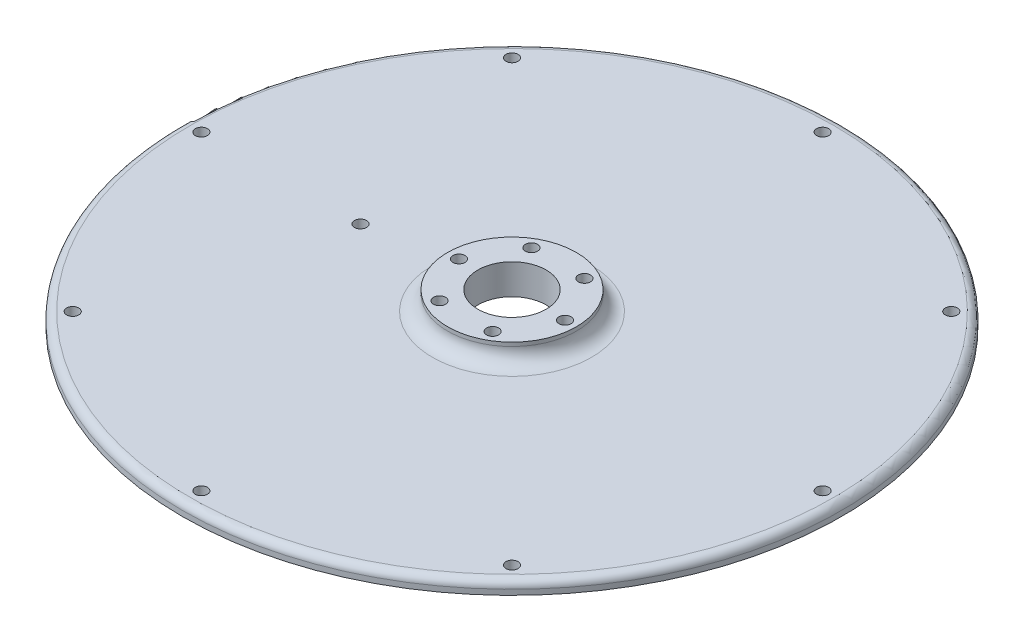
from build123d import *

# Parameters (mm, degrees)
CUT_EXTRUDE1_DEPTH      = 617.614952787
CUT_EXTRUDE1_DEPTH_BACK = 617.614952787
SKETCH2_R               = 8
CUT_EXTRUDE2_DEPTH      = 618.636624562
CUT_EXTRUDE2_DEPTH_BACK = 20
SKETCH3_R               = 8
SKETCH4_R               = 8
CUT_EXTRUDE3_DEPTH      = 15


with BuildPart() as part:
    # Sketch1 → Revolve1 (revolve)
    with BuildSketch(Plane.XY, mode=Mode.PRIVATE) as revolve1_sk:
        with BuildLine():
            Line((-365, 0), (-385, 0))
            Line((-385, 0), (-385, 13))
            Line((-385, 13), (-435, 13))
            Line((-435, 13), (-435, 20))
            ThreePointArc((-435, 20), (-432.071067812, 27.071067812), (-425, 30))
            Line((-425, 30), (-105, 30))
            ThreePointArc((-105, 30), (-90.857864376, 35.857864376), (-85, 50))
            Line((-85, 50), (-85, 55))
            Line((-85, 55), (-45, 55))
            Line((-45, 55), (-45, 15))
            Line((-45, 15), (-355, 15))
            ThreePointArc((-355, 15), (-362.071067812, 12.071067812), (-365, 5))
            Line((-365, 5), (-365, 0))
        make_face()
    revolve(revolve1_sk.sketch.rotate(Axis((0, 0, 0), (0, 1, 0)), 270), axis=Axis((0, 0, 0), (0, 1, 0)))

    # Sketch2 → Cut-Extrude1 (cut, two sides: drawn at the far end of the back side and taken through both)
    with BuildSketch(Plane.XZ.offset(-13).offset(-CUT_EXTRUDE1_DEPTH_BACK)):
        with Locations(Location((410, 0, 0), (0, 0, 270))):
            Circle(SKETCH2_R)
        with Locations(Location((289.913780286, -289.913780286, 0), (0, 0, 270))):
            Circle(SKETCH2_R)
        with Locations(Location((0, -410, 0), (0, 0, 270))):
            Circle(SKETCH2_R)
        with Locations(Location((-289.913780286, -289.913780286, 0), (0, 0, 270))):
            Circle(SKETCH2_R)
        with Locations(Location((-410, 0, 0), (0, 0, 270))):
            Circle(SKETCH2_R)
        with Locations(Location((-289.913780286, 289.913780286, 0), (0, 0, 270))):
            Circle(SKETCH2_R)
        with Locations(Location((0, 410, 0), (0, 0, 270))):
            Circle(SKETCH2_R)
        with Locations(Location((289.913780286, 289.913780286, 0), (0, 0, 270))):
            Circle(SKETCH2_R)
    extrude(amount=CUT_EXTRUDE1_DEPTH + CUT_EXTRUDE1_DEPTH_BACK, mode=Mode.SUBTRACT)

    # Sketch3 → Cut-Extrude2 (cut, two sides: drawn at the far end of the back side and taken through both)
    with BuildSketch(Plane(origin=(0, 55, 0), x_dir=(1, 0, 0), z_dir=(0, 1, 0)).offset(-CUT_EXTRUDE2_DEPTH_BACK)):
        with Locations(Location((70, 0, 0), (0, 0, 90))):
            Circle(SKETCH3_R)
        with Locations(Location((35, -60.621778265, 0), (0, 0, 90))):
            Circle(SKETCH3_R)
        with Locations(Location((-35, -60.621778265, 0), (0, 0, 90))):
            Circle(SKETCH3_R)
        with Locations(Location((-70, 0, 0), (0, 0, 90))):
            Circle(SKETCH3_R)
        with Locations(Location((-35, 60.621778265, 0), (0, 0, 90))):
            Circle(SKETCH3_R)
        with Locations(Location((35, 60.621778265, 0), (0, 0, 90))):
            Circle(SKETCH3_R)
    extrude(amount=CUT_EXTRUDE2_DEPTH + CUT_EXTRUDE2_DEPTH_BACK, mode=Mode.SUBTRACT)

    # Sketch4 → Cut-Extrude3 (cut)
    with BuildSketch(Plane(origin=(0, 30, 0), x_dir=(1, 0, 0), z_dir=(0, 1, 0))):
        with Locations(Location((-200, 0, 0), (0, 0, 270))):
            Circle(SKETCH4_R)
    extrude(amount=-CUT_EXTRUDE3_DEPTH, mode=Mode.SUBTRACT)


solid = part.part
